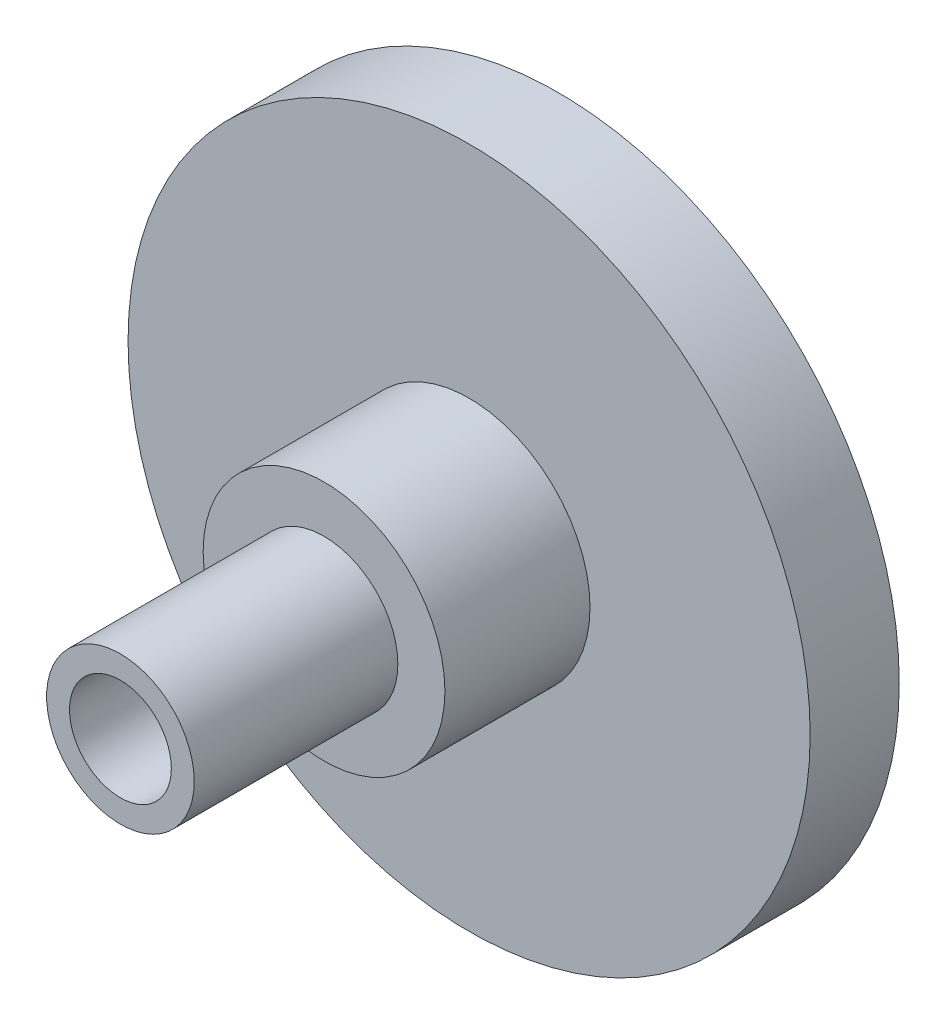
from build123d import *

# Parameters (mm, degrees)
SKETCH_1_R      = 6.7
SKETCH_1_R_2    = 1
EXTRUDE_1_DEPTH = 1.75
SKETCH_2_R      = 2.375
SKETCH_2_R_2    = 1
EXTRUDE_2_DEPTH = 2.85
SKETCH_3_R      = 1.45
SKETCH_3_R_2    = 1
EXTRUDE_3_DEPTH = 4


with BuildPart() as part:
    # 草图1 → 凸台-拉伸1 (new body)
    with BuildSketch(Plane.XY):
        Circle(SKETCH_1_R)
        Circle(SKETCH_1_R_2, mode=Mode.SUBTRACT)
    extrude(amount=EXTRUDE_1_DEPTH)

    # 草图2 → 凸台-拉伸2 (add)
    with BuildSketch(Plane.XY.offset(1.75)):
        Circle(SKETCH_2_R)
        Circle(SKETCH_2_R_2, mode=Mode.SUBTRACT)
    extrude(amount=EXTRUDE_2_DEPTH)

    # 草图3 → 凸台-拉伸3 (add)
    with BuildSketch(Plane.XY.offset(4.6)):
        Circle(SKETCH_3_R)
        Circle(SKETCH_3_R_2, mode=Mode.SUBTRACT)
    extrude(amount=EXTRUDE_3_DEPTH)


solid = part.part
